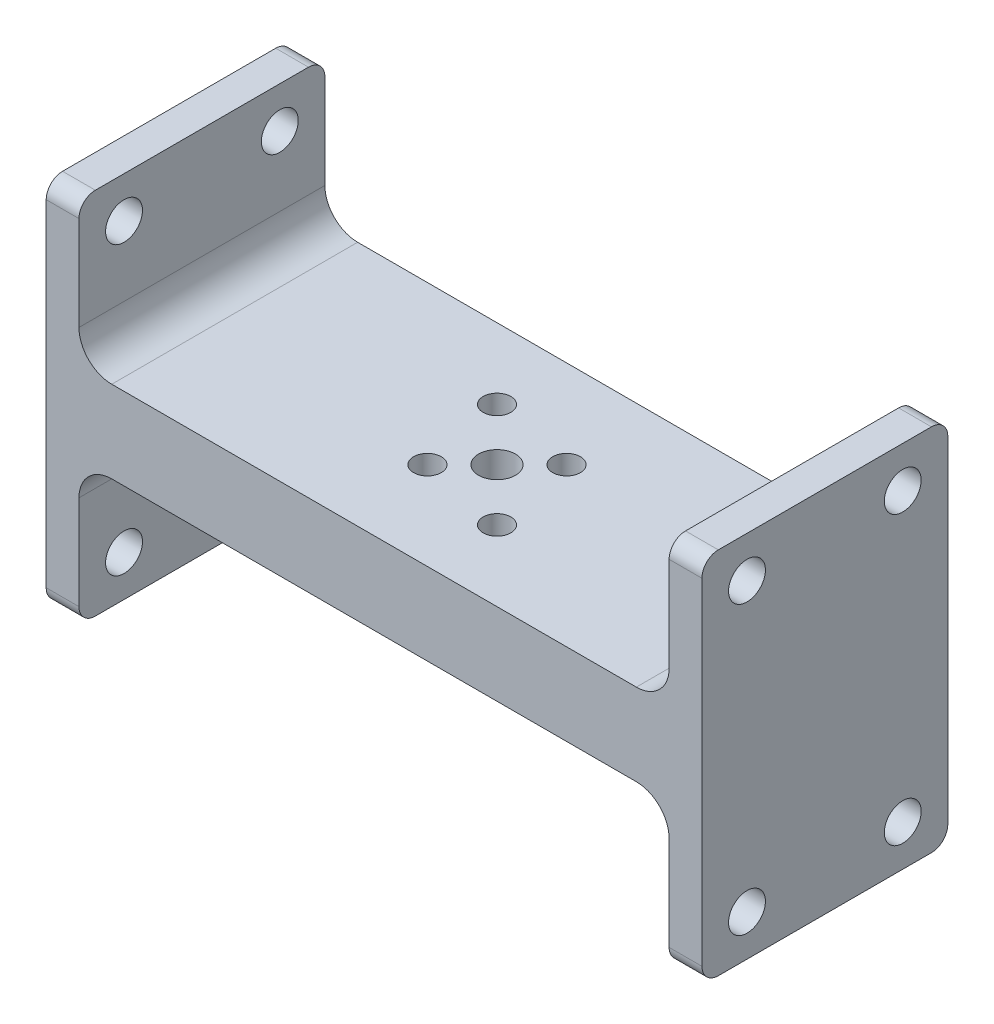
from build123d import *

# Parameters (mm, degrees)
SKETCH2_W           = 72
SKETCH2_H           = 30
SKETCH2_R           = 2.25
SKETCH2_R_2         = 1.6875
BOSS_EXTRUDE1_DEPTH = 10
SKETCH3_W           = 30
SKETCH3_H           = 45
SKETCH3_R           = 2.25
BOSS_EXTRUDE2_DEPTH = 4
FILLET1_R           = 4
FILLET2_R           = 2


with BuildPart() as part:
    # Sketch2 → Boss-Extrude1 (new body)
    with BuildSketch(Plane(origin=(0, 0, 0), x_dir=(1, 0, 0), z_dir=(0, 1, 0))):
        Rectangle(SKETCH2_W, SKETCH2_H)
        with Locations(Location((0, 0, 0), (0, 0, 270))):
            Circle(SKETCH2_R, mode=Mode.SUBTRACT)
        with Locations(Location((-6.363961031, 6.363961031, 0), (0, 0, 270))):
            Circle(SKETCH2_R_2, mode=Mode.SUBTRACT)
        with Locations(Location((6.363961031, -6.363961031, 0), (0, 0, 270))):
            Circle(SKETCH2_R_2, mode=Mode.SUBTRACT)
        with Locations(Location((4.242640687, 4.242640687, 0), (0, 0, 270))):
            Circle(SKETCH2_R_2, mode=Mode.SUBTRACT)
        with Locations(Location((-4.242640687, -4.242640687, 0), (0, 0, 270))):
            Circle(SKETCH2_R_2, mode=Mode.SUBTRACT)
    extrude(amount=BOSS_EXTRUDE1_DEPTH)

    # Sketch3 → Boss-Extrude2 (add)
    with BuildSketch(Plane.ZY.offset(36)):
        with Locations((0, 5)):
            Rectangle(SKETCH3_W, SKETCH3_H)
        with Locations((-9.5, 22.5)):
            Circle(SKETCH3_R, mode=Mode.SUBTRACT)
        with Locations((-9.5, -12.5)):
            Circle(SKETCH3_R, mode=Mode.SUBTRACT)
        with Locations((9.5, -12.5)):
            Circle(SKETCH3_R, mode=Mode.SUBTRACT)
        with Locations((9.5, 22.5)):
            Circle(SKETCH3_R, mode=Mode.SUBTRACT)
    boss_extrude2 = extrude(amount=BOSS_EXTRUDE2_DEPTH)

    # Mirror1: Boss-Extrude2 across plane
    add(boss_extrude2.mirror(Plane(origin=(0, 0, 0), x_dir=(0, 0, 1), z_dir=(1, 0, 0))))

    # Fillet1
    fillet1_edges = [part.edges().sort_by_distance(p)[0] for p in [
        (-36, 10, 0),
        (-36, 0, 0),
        (36, 0, 0),
        (36, 10, 0),
    ]]
    fillet(fillet1_edges, radius=FILLET1_R)

    # Fillet2
    fillet2_edges = [part.edges().sort_by_distance(p)[0] for p in [
        (-38, 27.5, 15),
        (-38, 27.5, -15),
        (-38, -17.5, -15),
        (-38, -17.5, 15),
        (38, 27.5, -15),
        (38, 27.5, 15),
        (38, -17.5, 15),
        (38, -17.5, -15),
    ]]
    fillet(fillet2_edges, radius=FILLET2_R)


solid = part.part
